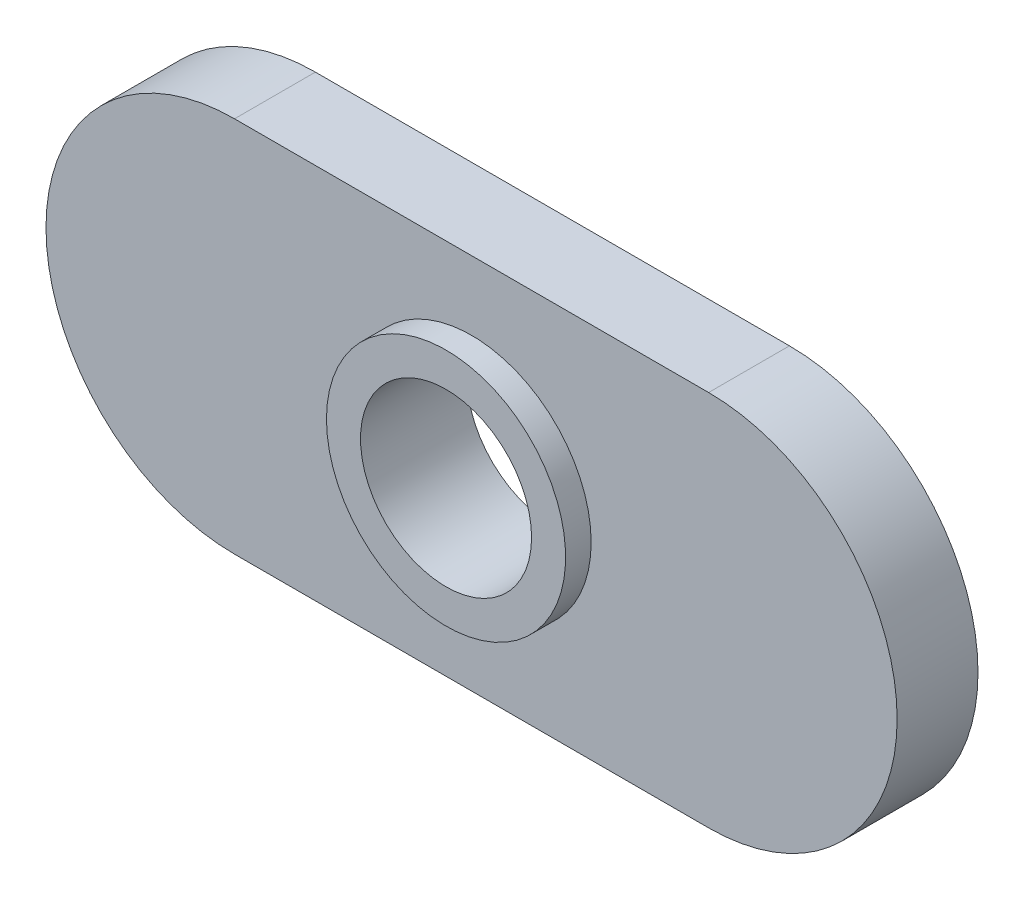
from build123d import *

# Parameters (mm, degrees)
BOSS_EXTRUDE1_DEPTH         = 2.413
SKETCH2_W                   = 3.5687
SKETCH2_H                   = 0.762
F_1_4_20_TAPPED_HOLE1_D     = 5.1054
F_1_4_20_TAPPED_HOLE1_DEPTH = 16.51
F_1_4_20_TAPPED_HOLE1_TIP   = 1.533816902


with BuildPart() as part:
    # Sketch1 → Boss-Extrude1 (new body)
    with BuildSketch(Plane.XY.offset(2.413)):
        with BuildLine():
            Line((111.27866266, 120.306965896), (125.42646266, 120.306965896))
            ThreePointArc((125.42646266, 120.306965896), (131.05256266, 125.933065896), (125.42646266, 131.559165896))
            Line((125.42646266, 131.559165896), (111.27866266, 131.559165896))
            ThreePointArc((111.27866266, 131.559165896), (105.65256266, 125.933065896), (111.27866266, 120.306965896))
        make_face()
    extrude(amount=-BOSS_EXTRUDE1_DEPTH)

    # Sketch2 → Revolve1 (revolve)
    with BuildSketch(Plane.XZ.offset(-125.933065896), mode=Mode.PRIVATE) as revolve1_sk:
        with Locations((120.13691266, 2.794)):
            Rectangle(SKETCH2_W, SKETCH2_H)
    revolve(revolve1_sk.sketch.rotate(Axis((118.35256266, 125.933065896, 3.175), (0, 0, -1)), 180), axis=Axis((118.35256266, 125.933065896, 3.175), (0, 0, -1)))

    # 1/4-20 Tapped Hole1
    with Locations(Plane.XY.offset(3.175)):
        with Locations((118.35256266, 125.933065896)):
            Hole(F_1_4_20_TAPPED_HOLE1_D / 2, depth=F_1_4_20_TAPPED_HOLE1_DEPTH)
            with Locations((0, 0, -(F_1_4_20_TAPPED_HOLE1_DEPTH + F_1_4_20_TAPPED_HOLE1_TIP / 2))):  # 118° drill point
                Cone(0, F_1_4_20_TAPPED_HOLE1_D / 2, F_1_4_20_TAPPED_HOLE1_TIP, mode=Mode.SUBTRACT)


solid = part.part
